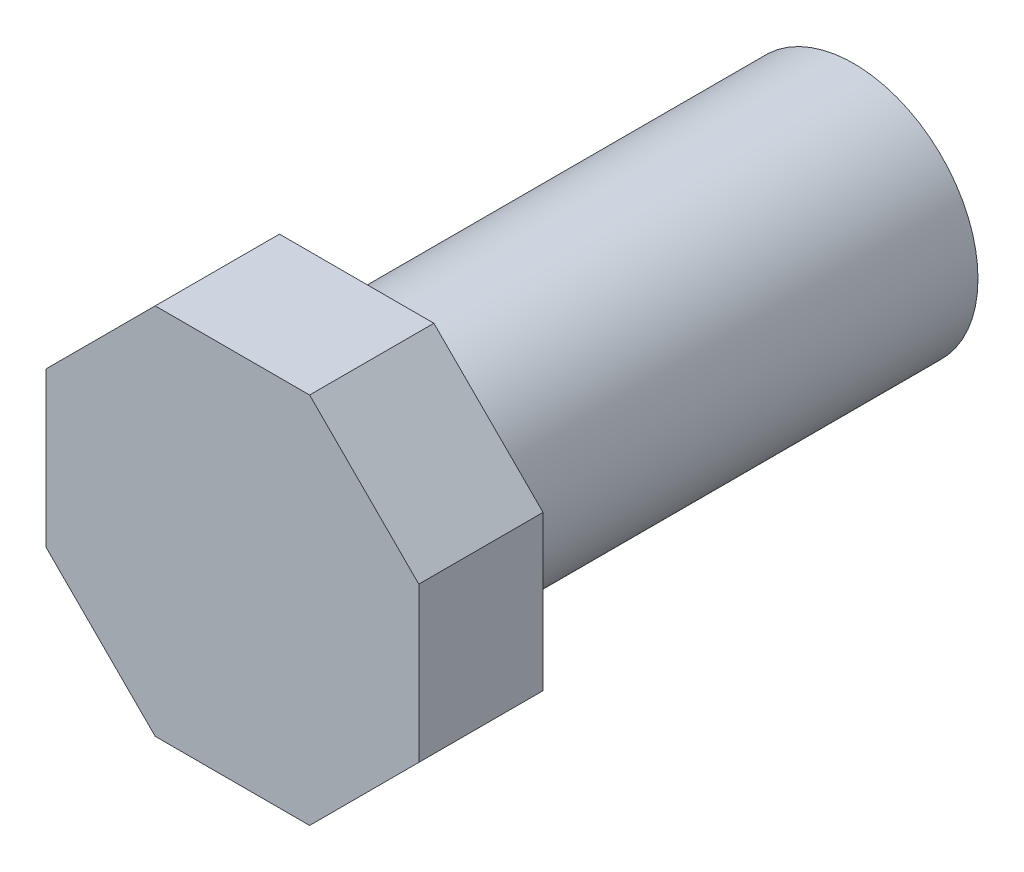
from build123d import *

# Parameters (mm, degrees)
ESQUISSE1_R        = 6.35
BOSS_EXTRU_1_DEPTH = 25.4
BOSS_EXTRU_2_DEPTH = 6.35


with BuildPart() as part:
    # Esquisse1 → Boss.-Extru.1 (new body)
    with BuildSketch(Plane.XY):
        Circle(ESQUISSE1_R)
    extrude(amount=BOSS_EXTRU_1_DEPTH)

    # Esquisse2 → Boss.-Extru.2 (add)
    with BuildSketch(Plane.XY.offset(25.4)):
        Polygon((9.525, 3.945384182), (3.945384182, 9.525), (-3.945384182, 9.525), (-9.525, 3.945384182), (-9.525, -3.945384182), (-3.945384182, -9.525), (3.945384182, -9.525), (9.525, -3.945384182), align=None)
    extrude(amount=BOSS_EXTRU_2_DEPTH)


solid = part.part
